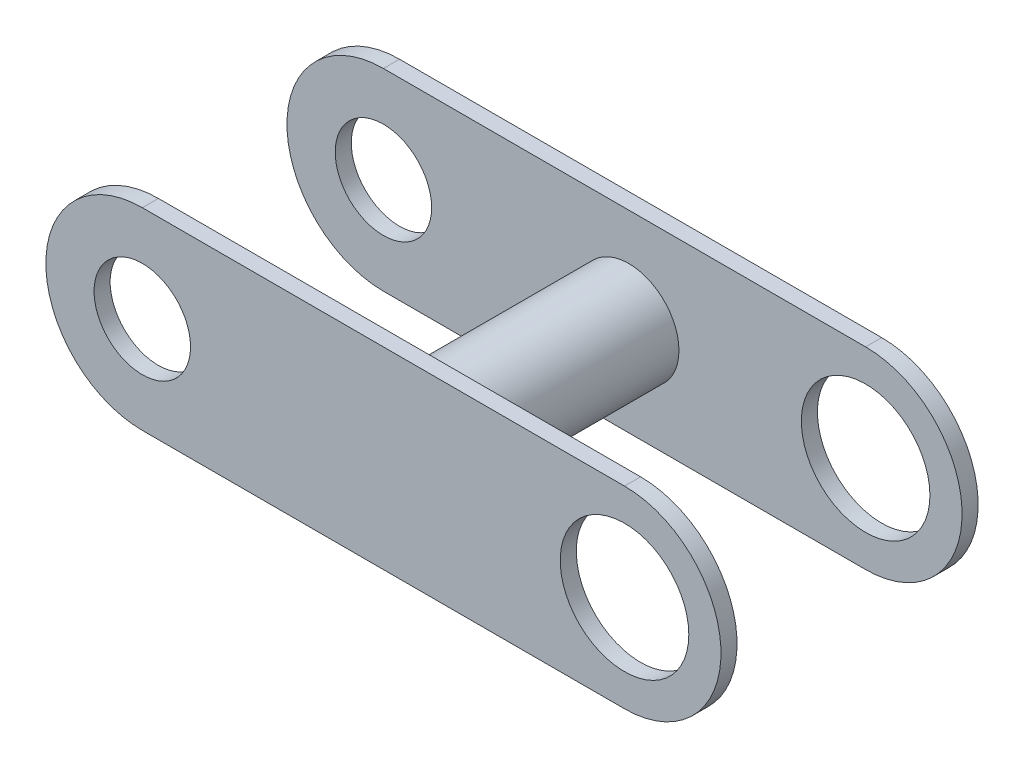
from build123d import *

# Parameters (mm, degrees)
SKETCH_1_R             = 15
SKETCH_1_R_2           = 20
EXTRUDE_1_DEPTH        = 5
SKETCH_2_R             = 15.619945806
EXTRUDE_2_DEPTH        = 70
PATTERN_LINEAR_1_COUNT = 2
PATTERN_LINEAR_1_PITCH = 75


with BuildPart() as part:
    # 草图1 → 凸台-拉伸1 (new body)
    with BuildSketch(Plane.XY):
        with BuildLine():
            Line((-31.598747919, 30), (118.401252081, 30))
            ThreePointArc((118.401252081, 30), (148.401252081, 0), (118.401252081, -30))
            Line((118.401252081, -30), (-31.598747919, -30))
            ThreePointArc((-31.598747919, -30), (-61.598747919, 0), (-31.598747919, 30))
        make_face()
        with Locations((-31.598747919, 0)):
            Circle(SKETCH_1_R, mode=Mode.SUBTRACT)
        with Locations((118.401252081, 0)):
            Circle(SKETCH_1_R_2, mode=Mode.SUBTRACT)
    extrude_1 = extrude(amount=EXTRUDE_1_DEPTH)

    # 草图2 → 凸台-拉伸2 (add)
    with BuildSketch(Plane.XY.offset(5)):
        with Locations((44.713404219, 0)):
            Circle(SKETCH_2_R)
    extrude(amount=EXTRUDE_2_DEPTH)

    # 阵列(线性)1: 凸台-拉伸1 ×2
    with Locations(*[(0, 0, i * PATTERN_LINEAR_1_PITCH) for i in range(1, PATTERN_LINEAR_1_COUNT)]):
        add(extrude_1)


solid = part.part
